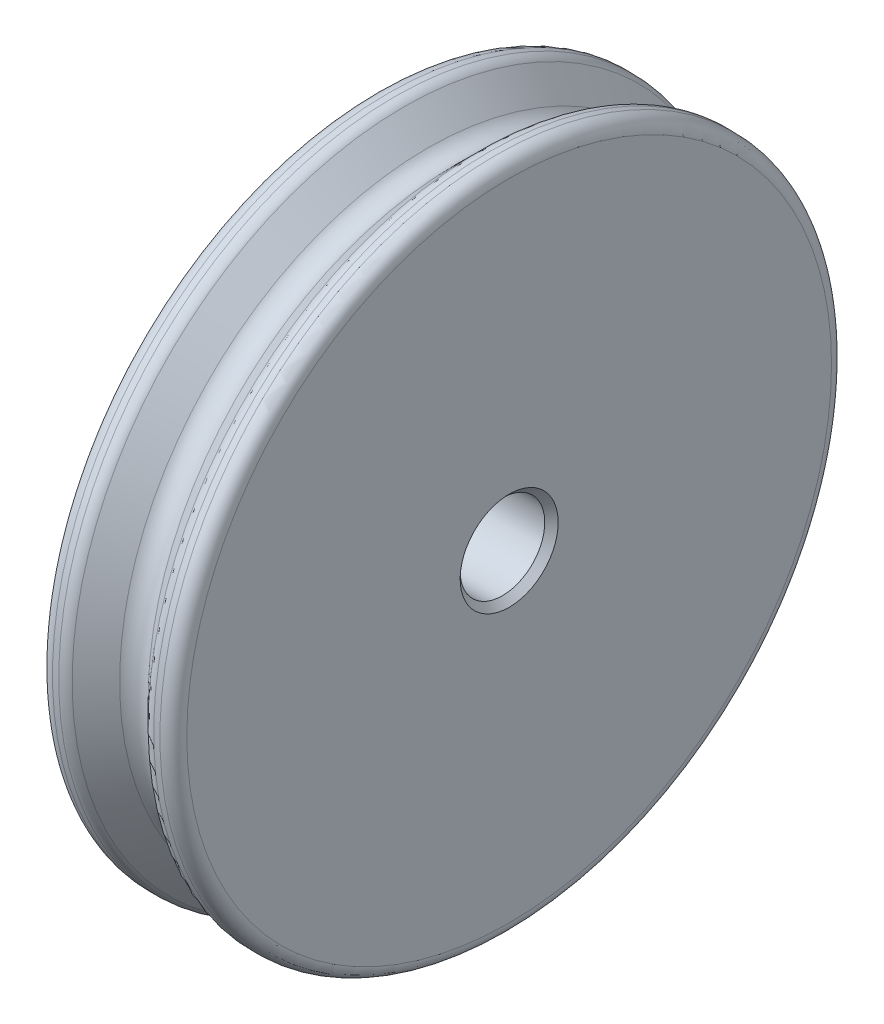
from build123d import *

# Parameters (mm, degrees)
CHANFREIN1_SIZE = 0.5
CONG_1_R        = 1


with BuildPart() as part:
    # Esquisse2 → Révolution1 (revolve)
    with BuildSketch(Plane.XY, mode=Mode.PRIVATE) as r_volution1_sk:
        with BuildLine():
            Line((3.121320344, 25), (5, 25))
            Line((5, 25), (5, 3.15))
            Line((5, 3.15), (-5, 3.15))
            Line((-5, 3.15), (-5, 25))
            Line((-5, 25), (-3.121320344, 25))
            Line((-3.121320344, 25), (-1.060660172, 22.939339828))
            ThreePointArc((-1.060660172, 22.939339828), (0, 22.5), (1.060660172, 22.939339828))
            Line((1.060660172, 22.939339828), (3.121320344, 25))
        make_face()
    revolve(r_volution1_sk.sketch.rotate(Axis((-80.838467618, 0, 0), (1, 0, 0)), 180), axis=Axis((-80.838467618, 0, 0), (1, 0, 0)))

    # Chanfrein1
    chanfrein1_edges = [part.edges().sort_by_distance(p)[0] for p in [
        (5, 3.15, 0),
        (-5, 3.15, 0),
    ]]
    chamfer(chanfrein1_edges, length=CHANFREIN1_SIZE)

    # Congé1
    cong_1_edges = [part.edges().sort_by_distance(p)[0] for p in [
        (3.121320344, 25, 0),
        (5, 25, 0),
        (-5, 25, 0),
        (-3.121320344, 25, 0),
    ]]
    fillet(cong_1_edges, radius=CONG_1_R)


solid = part.part
